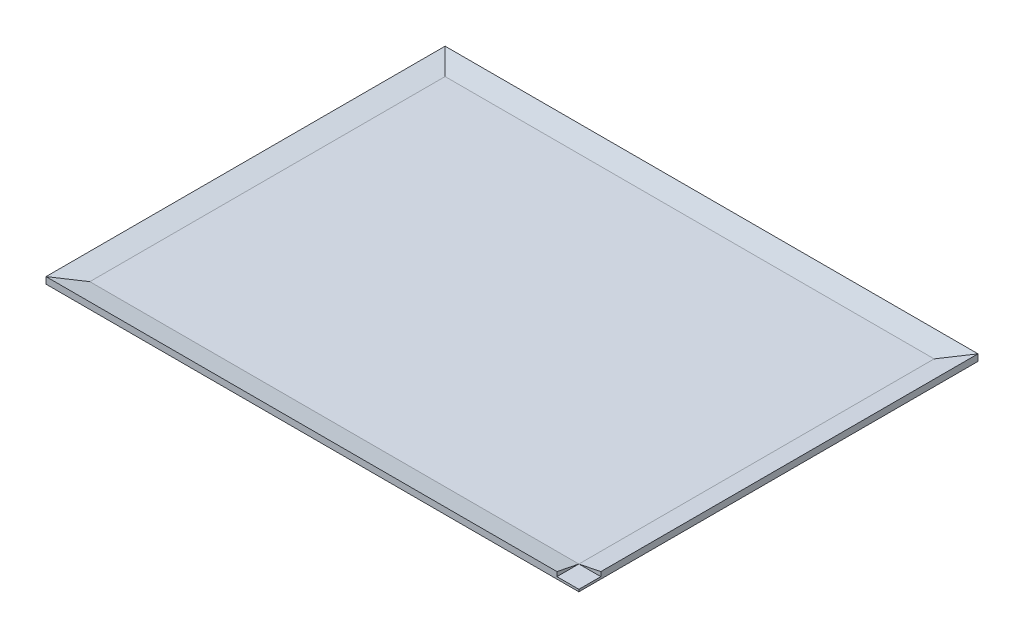
from build123d import *

# Parameters (mm, degrees)
SKETCH_1_W      = 2430
SKETCH_1_H      = 1820
EXTRUDE_2_DEPTH = 10


with BuildPart() as part:
    # Эскиз1 → Выдавливание2 (new body)
    with BuildSketch(Plane(origin=(0, 0, 0), x_dir=(-1, 0, 0), z_dir=(0, 1, 0))):
        Rectangle(SKETCH_1_W, SKETCH_1_H)
    extrude(amount=-EXTRUDE_2_DEPTH)

    # Sweep 1: sweep along a curve in space
    with BuildLine() as sweep_1_path:
        Line((-1115, 0, 810), (-1115, 0, 0))
        Line((1115, 0, 810), (-1115, 0, 810))
    # Эскиз2 → Sweep 1 (sweep)
    with BuildSketch(Plane.XY):
        Polygon((-1115, 0), (-1215, 20), (-1215, 0), align=None)
    sweep(path=sweep_1_path.line, transition=Transition.RIGHT)

    # Sweep 1 2: sweep along a curve in space
    with BuildLine() as sweep_1_2_path:
        Line((1115, 0, -810), (1115, 0, 810))
        Line((-1115, 0, -810), (1115, 0, -810))
        Line((-1115, 0, 0), (-1115, 0, -810))
    # Эскиз2<2> → Sweep 1 2 (sweep)
    with BuildSketch(Plane.XY):
        Polygon((-1115, 0), (-1215, 20), (-1215, 0), align=None)
    sweep(path=sweep_1_2_path.line, transition=Transition.RIGHT)


solid = part.part
